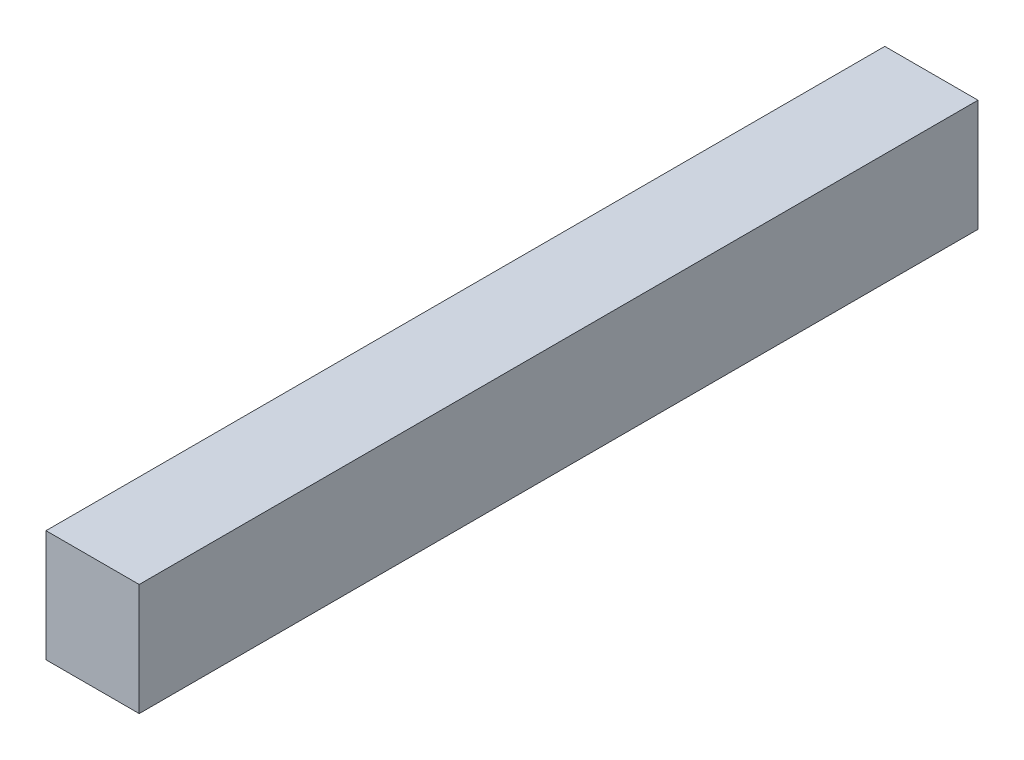
from build123d import *

# Parameters (mm, degrees)
SKETCH1_W           = 25
SKETCH1_H           = 225
BOSS_EXTRUDE1_DEPTH = 30


with BuildPart() as part:
    # Sketch1 → Boss-Extrude1 (new body)
    with BuildSketch(Plane(origin=(0, 0, 0), x_dir=(1, 0, 0), z_dir=(0, 1, 0))):
        Rectangle(SKETCH1_W, SKETCH1_H)
    extrude(amount=-BOSS_EXTRUDE1_DEPTH)


solid = part.part
